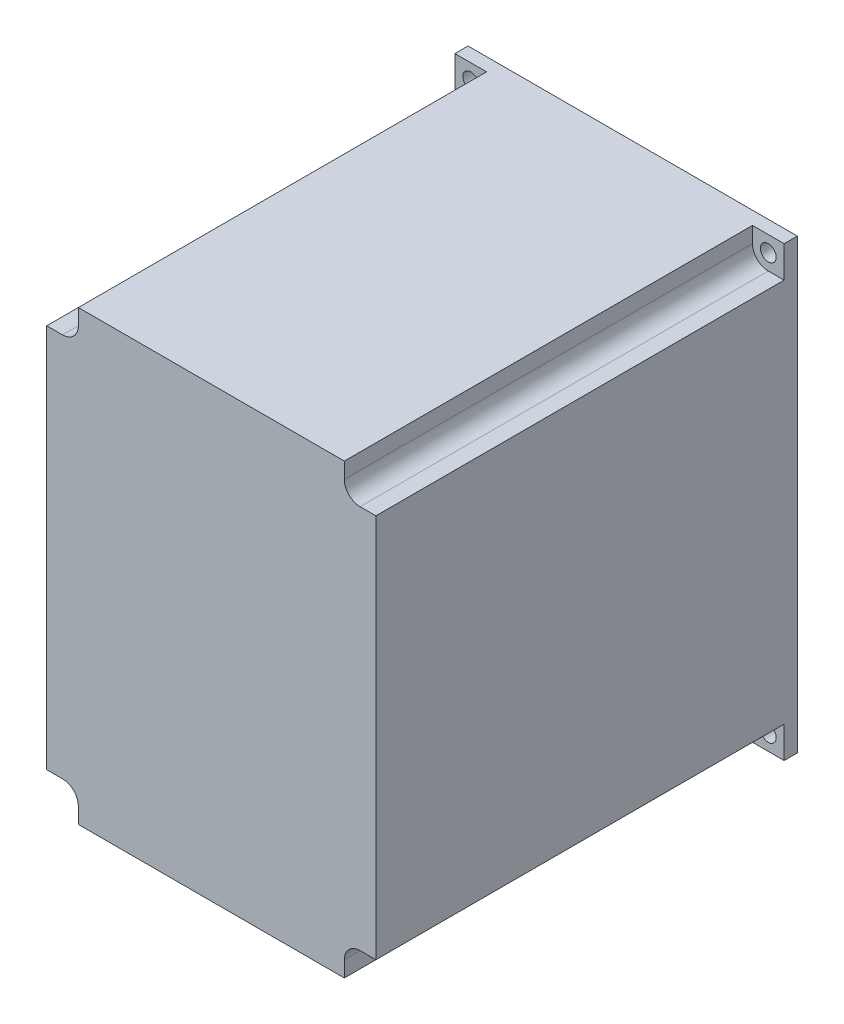
from build123d import *

# Parameters (mm, degrees)
SKETCH1_W               = 125
SKETCH1_H               = 170
BOSS_EXTRUDE1_DEPTH     = 160
SKETCH2_R               = 3
CUT_EXTRUDE1_DEPTH      = 155
SKETCH2_3_R             = 3
CUT_EXTRUDE2_DEPTH      = 192.653985088
MIRROR2_COPY_1_SKETCH_R = 3
MIRROR2_COPY_1_DEPTH    = 155
MIRROR2_COPY_2_SKETCH_R = 3
MIRROR2_COPY_2_DEPTH    = 192.653985088


with BuildPart() as part:
    # Sketch1 → Boss-Extrude1 (new body)
    with BuildSketch(Plane.XY):
        Rectangle(SKETCH1_W, SKETCH1_H)
    extrude(amount=BOSS_EXTRUDE1_DEPTH)

    # Sketch2 → Cut-Extrude1 (cut)
    # profile 1 of 2: a face of its own
    with BuildSketch(Plane.XY.offset(160)):
        with BuildLine():
            Line((-50.5, 85), (-62.5, 85))
            Line((-62.5, 85), (-62.5, 73))
            Line((-62.5, 73), (-56.5, 73))
            ThreePointArc((-56.5, 73), (-52.257359313, 74.757359313), (-50.5, 79))
            Line((-50.5, 79), (-50.5, 85))
        make_face()
        with Locations((-56.5, 79)):
            Circle(SKETCH2_R, mode=Mode.SUBTRACT)
    # profile 2 of 2: a face of its own
    with BuildSketch(Plane.XY.offset(160)):
        with Locations((-56.5, 79)):
            Circle(SKETCH2_R)
    cut_extrude1 = extrude(amount=-CUT_EXTRUDE1_DEPTH, mode=Mode.SUBTRACT)

    # Sketch2<3> → Cut-Extrude2 (cut, through all)
    with BuildSketch(Plane.XY.offset(160)):
        with Locations((-56.5, 79)):
            Circle(SKETCH2_3_R)
    cut_extrude2 = extrude(amount=-CUT_EXTRUDE2_DEPTH, mode=Mode.SUBTRACT)

    # Mirror1: Cut-Extrude1, Cut-Extrude2 across plane
    add(cut_extrude1.mirror(Plane.ZX), mode=Mode.SUBTRACT)
    add(cut_extrude2.mirror(Plane.ZX), mode=Mode.SUBTRACT)

    # Mirror2: Cut-Extrude1, Cut-Extrude2 across plane
    add(cut_extrude1.mirror(Plane(origin=(0, 0, 0), x_dir=(0, 0, 1), z_dir=(1, 0, 0))), mode=Mode.SUBTRACT)
    add(cut_extrude2.mirror(Plane(origin=(0, 0, 0), x_dir=(0, 0, 1), z_dir=(1, 0, 0))), mode=Mode.SUBTRACT)

    # Mirror2 copy 1 sketch → Mirror2 copy 1 (cut)
    # profile 1 of 2: a face of its own
    with BuildSketch(Plane(origin=(0, 0, 160), x_dir=(-1, 0, 0), z_dir=(0, 0, 1))):
        with BuildLine():
            Line((-50.5, 85), (-62.5, 85))
            Line((-62.5, 85), (-62.5, 73))
            Line((-62.5, 73), (-56.5, 73))
            ThreePointArc((-56.5, 73), (-52.257359313, 74.757359313), (-50.5, 79))
            Line((-50.5, 79), (-50.5, 85))
        make_face()
        with Locations((-56.5, 79)):
            Circle(MIRROR2_COPY_1_SKETCH_R, mode=Mode.SUBTRACT)
    # profile 2 of 2: a face of its own
    with BuildSketch(Plane(origin=(0, 0, 160), x_dir=(-1, 0, 0), z_dir=(0, 0, 1))):
        with Locations((-56.5, 79)):
            Circle(MIRROR2_COPY_1_SKETCH_R)
    extrude(amount=-MIRROR2_COPY_1_DEPTH, mode=Mode.SUBTRACT)

    # Mirror2 copy 2 sketch → Mirror2 copy 2 (cut, through all)
    with BuildSketch(Plane(origin=(0, 0, 160), x_dir=(-1, 0, 0), z_dir=(0, 0, 1))):
        with Locations((-56.5, 79)):
            Circle(MIRROR2_COPY_2_SKETCH_R)
    extrude(amount=-MIRROR2_COPY_2_DEPTH, mode=Mode.SUBTRACT)


solid = part.part
